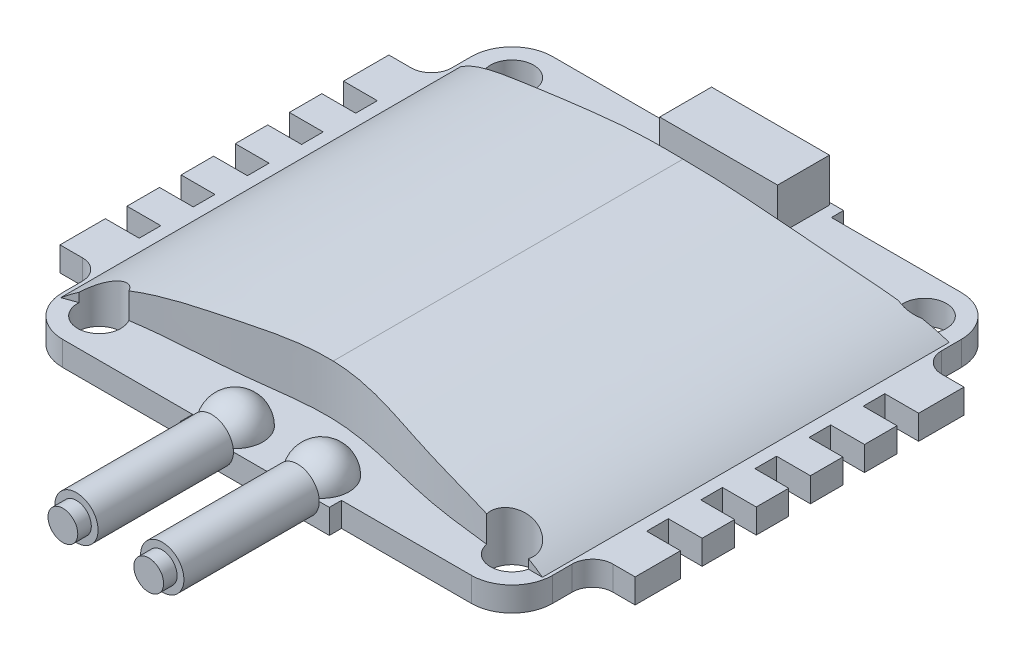
from build123d import *

# Parameters (mm, degrees)
ESQUISSE1_R             = 1.6
BOSS_EXTRU_1_DEPTH      = 1.8
ESQUISSE2_W             = 2.5
ESQUISSE2_H             = 1.6
ENL_V_MAT_EXTRU_1_DEPTH = 2
ESQUISSE4_R             = 1.6
BOSS_EXTRU_2_DEPTH      = 10
ESQUISSE5_R             = 1.1
BOSS_EXTRU_3_DEPTH      = 1
ESQUISSE6_W             = 8.712464533
ESQUISSE6_H             = 3.834081139
BOSS_EXTRU_4_DEPTH      = 3.2
ENL_V_MAT_EXTRU_2_DEPTH = 3.2
BOSS_EXTRU_5_DEPTH      = 15.6
ENL_V_MAT_EXTRU_3_DEPTH = 31.2
ESQUISSE11_R            = 1.6
ENL_V_MAT_EXTRU_4_DEPTH = 31.2
ESQUISSE12_W            = 3.067769554
ESQUISSE12_H            = 3.219264347
ESQUISSE12_W_2          = 3.863117217
ESQUISSE12_H_2          = 3.598001329
ESQUISSE12_W_3          = 4.203980501
ESQUISSE12_H_3          = 3.78736982
ESQUISSE12_H_4          = 3.522253933
ESQUISSE12_W_4          = 2.992022158
ESQUISSE12_H_5          = 2.878401063
BOSS_EXTRU_6_DEPTH      = 1
ESQUISSE13_W            = 1.249832041
ESQUISSE13_H            = 2.234548194
ESQUISSE13_W_2          = 1.287705739
ESQUISSE13_H_2          = 1.931558609
ESQUISSE13_W_3          = 1.325579437
ESQUISSE13_H_3          = 1.893684911
BOSS_EXTRU_7_DEPTH      = 1.4


with BuildPart() as part:
    # Esquisse1 → Boss.-Extru.1 (new body)
    with BuildSketch(Plane(origin=(0, 0, 0), x_dir=(1, 0, 0), z_dir=(0, 1, 0))):
        with BuildLine():
            Line((-5.5, 18.1), (-5.5, 19))
            Line((-5.5, 19), (5.5, 19))
            Line((5.5, 19), (5.5, 18.1))
            Line((5.5, 18.1), (15.1, 18.1))
            ThreePointArc((15.1, 18.1), (17.221320344, 17.221320344), (18.1, 15.1))
            Line((18.1, 15.1), (18.1, 13.65))
            ThreePointArc((18.1, 13.65), (18.539339828, 12.589339828), (19.6, 12.15))
            Line((19.6, 12.15), (21.25, 12.15))
            Line((21.25, 12.15), (21.25, -12.15))
            Line((21.25, -12.15), (19.6, -12.15))
            ThreePointArc((19.6, -12.15), (18.539339828, -12.589339828), (18.1, -13.65))
            Line((18.1, -13.65), (18.1, -15.1))
            ThreePointArc((18.1, -15.1), (17.221320344, -17.221320344), (15.1, -18.1))
            Line((15.1, -18.1), (5.5, -18.1))
            Line((5.5, -18.1), (5.5, -19))
            Line((5.5, -19), (-5.5, -19))
            Line((-5.5, -19), (-5.5, -18.1))
            Line((-5.5, -18.1), (-15.1, -18.1))
            ThreePointArc((-15.1, -18.1), (-17.221320344, -17.221320344), (-18.1, -15.1))
            Line((-18.1, -15.1), (-18.1, -13.65))
            ThreePointArc((-18.1, -13.65), (-18.539339828, -12.589339828), (-19.6, -12.15))
            Line((-19.6, -12.15), (-21.25, -12.15))
            Line((-21.25, -12.15), (-21.25, 12.15))
            Line((-21.25, 12.15), (-19.6, 12.15))
            ThreePointArc((-19.6, 12.15), (-18.539339828, 12.589339828), (-18.1, 13.65))
            Line((-18.1, 13.65), (-18.1, 15.1))
            ThreePointArc((-18.1, 15.1), (-17.221320344, 17.221320344), (-15.1, 18.1))
            Line((-15.1, 18.1), (-5.5, 18.1))
        make_face()
        with Locations(Location((-15.25, 15.25, 0), (0, 0, 270))):
            Circle(ESQUISSE1_R, mode=Mode.SUBTRACT)
        with Locations(Location((15.25, 15.25, 0), (0, 0, 270))):
            Circle(ESQUISSE1_R, mode=Mode.SUBTRACT)
        with Locations(Location((15.25, -15.25, 0), (0, 0, 270))):
            Circle(ESQUISSE1_R, mode=Mode.SUBTRACT)
        with Locations(Location((-15.25, -15.25, 0), (0, 0, 270))):
            Circle(ESQUISSE1_R, mode=Mode.SUBTRACT)
    extrude(amount=BOSS_EXTRU_1_DEPTH)

    # Esquisse2 → Enlèv. mat.-Extru.1 (cut)
    with BuildSketch(Plane(origin=(0, 1.8, 0), x_dir=(1, 0, 0), z_dir=(0, 1, 0))):
        with Locations((-20, 0)):
            Rectangle(ESQUISSE2_W, ESQUISSE2_H)
        with Locations((-20, 4)):
            Rectangle(ESQUISSE2_W, ESQUISSE2_H)
        with Locations((-20, 8)):
            Rectangle(ESQUISSE2_W, ESQUISSE2_H)
        with Locations((-20, -4)):
            Rectangle(ESQUISSE2_W, ESQUISSE2_H)
        with Locations((-20, -8)):
            Rectangle(ESQUISSE2_W, ESQUISSE2_H)
        with Locations((20, -8)):
            Rectangle(ESQUISSE2_W, ESQUISSE2_H)
        with Locations((20, -4)):
            Rectangle(ESQUISSE2_W, ESQUISSE2_H)
        with Locations((20, 8)):
            Rectangle(ESQUISSE2_W, ESQUISSE2_H)
        with Locations((20, 4)):
            Rectangle(ESQUISSE2_W, ESQUISSE2_H)
        with Locations((20, 0)):
            Rectangle(ESQUISSE2_W, ESQUISSE2_H)
    extrude(amount=-ENL_V_MAT_EXTRU_1_DEPTH, mode=Mode.SUBTRACT)

    # Esquisse3 → Révolution1 (revolve)
    with BuildSketch(Plane(origin=(0, 1.8, 0), x_dir=(1, 0, 0), z_dir=(0, 1, 0))):
        with BuildLine():
            Line((-3.186801177, -15.220697473), (-3.186801177, -19.320115289))
            ThreePointArc((-3.186801177, -19.320115289), (-5.236510085, -17.270406381), (-3.186801177, -15.220697473))
        make_face()
    r_volution1 = revolve(axis=Axis((-3.186801177, 1.8, 15.220697473), (0, 0, 1)))

    # Symétrie1: Révolution1 across plane
    add(r_volution1.mirror(Plane(origin=(0, 0, 0), x_dir=(0, 0, 1), z_dir=(1, 0, 0))))

    # Esquisse4 → Boss.-Extru.2 (add)
    with BuildSketch(Plane.XY.offset(19)):
        with Locations((-3.186801177, 1.8)):
            Circle(ESQUISSE4_R)
        with Locations((3.155066641, 1.8)):
            Circle(ESQUISSE4_R)
    extrude(amount=BOSS_EXTRU_2_DEPTH)

    # Esquisse5 → Boss.-Extru.3 (add)
    with BuildSketch(Plane.XY.offset(29)):
        with Locations((-3.186801177, 1.8)):
            Circle(ESQUISSE5_R)
        with Locations((3.155066641, 1.8)):
            Circle(ESQUISSE5_R)
    extrude(amount=BOSS_EXTRU_3_DEPTH)

    # Esquisse6 → Boss.-Extru.4 (add)
    with BuildSketch(Plane(origin=(0, 1.8, 0), x_dir=(1, 0, 0), z_dir=(0, 1, 0))):
        with Locations((0.280971792, 16.903315945)):
            Rectangle(ESQUISSE6_W, ESQUISSE6_H)
    extrude(amount=BOSS_EXTRU_4_DEPTH)

    # Esquisse7 → Enlèv. mat.-Extru.2 (cut)
    with BuildSketch(Plane(origin=(0, 0, -18.820356514), x_dir=(-1, 0, 0), z_dir=(0, 0, -1))):
        Polygon((3.465666112, 4.708829175), (-4.027609697, 4.708829175), (-4.027609697, 4.28888017), (-4.27257995, 4.28888017), (-4.27257995, 3.833935414), (-4.027609697, 3.833935414), (-4.027609697, 2.142474142), (3.465666112, 2.142474142), (3.465666112, 3.833935414), (3.710636365, 3.833935414), (3.710636365, 4.28888017), (3.465666112, 4.28888017), align=None)
    extrude(amount=-ENL_V_MAT_EXTRU_2_DEPTH, mode=Mode.SUBTRACT)


with BuildPart() as body_2:
    # Esquisse9 → Boss.-Extru.5 (new, symmetric)
    with BuildSketch(Plane.XY):
        with BuildLine():
            Line((-17.847532768, 1.8), (17.847532768, 1.8))
            add(Edge.make_bspline(
                [(0, 5.518589903), (2.161733922, 5.518589903), (5.029769177, 5.403714898), (12.242026384, 4.339293522), (16.298826396, 2.963074297), (17.847532768, 1.8)],
                knots=[0, 0, 0, 0, 0.308769941, 0.708153595, 1, 1, 1, 1], degree=3))
            add(Edge.make_bspline(
                [(0, 5.518589903), (-2.161733922, 5.518589903), (-5.029769177, 5.403714898), (-12.242026384, 4.339293522), (-16.298826396, 2.963074297), (-17.847532768, 1.8)],
                knots=[0, 0, 0, 0, 0.308769941, 0.708153595, 1, 1, 1, 1], degree=3))
        make_face()
    extrude(amount=BOSS_EXTRU_5_DEPTH, both=True)

    # Esquisse10 → Enlèv. mat.-Extru.3 (cut)
    with BuildSketch(Plane(origin=(0, 1.8, 0), x_dir=(1, 0, 0), z_dir=(0, 1, 0))):
        with BuildLine():
            Line((19.80794416, 15.118911588), (19.80794416, 29.571030039))
            Line((19.80794416, 29.571030039), (-30.157401828, 26.429634015))
            Line((-30.157401828, 26.429634015), (-20.679039219, 15.118911588))
            add(Edge.make_bspline(
                [(-20.679039219, 15.118911588), (-15.331920911, 12.7470164), (-1.647863492, 12.82009705), (12.057948403, 12.231953741), (19.80794416, 15.118911588)],
                knots=[0, 0, 0, 0, 0.412002892, 1, 1, 1, 1], degree=3))
        make_face()
        with BuildLine():
            Line((-19.883691557, -16.505626412), (-33.612937455, -29.801354811))
            Line((-33.612937455, -29.801354811), (42.17324162, -39.147007981))
            Line((42.17324162, -39.147007981), (21.51226058, -16.922237092))
            add(Edge.make_bspline(
                [(-19.883691557, -16.505626412), (-15.597575438, -13.949476292), (-8.791721797, -14.369633321), (0.885215924, -12.61660088), (9.97905151, -15.714344907), (17.309674428, -15.632963874), (21.51226058, -16.922237092)],
                knots=[0, 0, 0, 0, 0.334206692, 0.481344855, 0.690017727, 1, 1, 1, 1], degree=3))
        make_face()
    extrude(amount=ENL_V_MAT_EXTRU_3_DEPTH, mode=Mode.SUBTRACT)

    # Combiner1: union part
    add(part.part)

    # Esquisse11 → Enlèv. mat.-Extru.4 (cut)
    with BuildSketch(Plane.XZ):
        with Locations(Location((15.25, -15.25, 0), (0, 0, 50.294055852))):
            Circle(ESQUISSE11_R)
        with Locations(Location((-15.25, -15.25, 0), (0, 0, 90))):
            Circle(ESQUISSE11_R)
        with Locations(Location((-15.25, 15.25, 0), (0, 0, 330.069666932))):
            Circle(ESQUISSE11_R)
        with Locations(Location((15.25, 15.25, 0), (0, 0, 169.194294943))):
            Circle(ESQUISSE11_R)
    extrude(amount=-ENL_V_MAT_EXTRU_4_DEPTH, mode=Mode.SUBTRACT)

    # Esquisse12 → Boss.-Extru.6 (add)
    with BuildSketch(Plane.XZ):
        with Locations((-5.169759805, 11.71460359)):
            Rectangle(ESQUISSE12_W, ESQUISSE12_H)
        with Locations((-6.021918015, 5.995675161)):
            Rectangle(ESQUISSE12_W_2, ESQUISSE12_H_2)
        with Locations((5.851486373, 5.995675161)):
            Rectangle(ESQUISSE12_W_3, ESQUISSE12_H_2)
        with Locations((6.911949922, 11.71460359)):
            Rectangle(ESQUISSE12_W, ESQUISSE12_H)
        with Locations((5.851486373, -7.468424551)):
            Rectangle(ESQUISSE12_W_3, ESQUISSE12_H_3)
        with Locations((-6.021918015, -7.600982495)):
            Rectangle(ESQUISSE12_W_2, ESQUISSE12_H_4)
        with Locations((-7.101318413, -12.997984489)):
            Rectangle(ESQUISSE12_W_4, ESQUISSE12_H_5)
        with Locations((4.791022823, -12.997984489)):
            Rectangle(ESQUISSE12_W, ESQUISSE12_H_5)
    extrude(amount=BOSS_EXTRU_6_DEPTH)

    # Esquisse13 → Boss.-Extru.7 (add)
    with BuildSketch(Plane.XZ):
        with Locations((-9.335866608, 8.11660226)):
            Rectangle(ESQUISSE13_W, ESQUISSE13_H)
        with Locations((1.950495458, 8.11660226)):
            Rectangle(ESQUISSE13_W, ESQUISSE13_H)
        with Locations((-2.764779969, -9.987025482)):
            Rectangle(ESQUISSE13_W_2, ESQUISSE13_H_2)
        with Locations((9.146498117, -10.384699313)):
            Rectangle(ESQUISSE13_W_3, ESQUISSE13_H_3)
    extrude(amount=BOSS_EXTRU_7_DEPTH)


solid = body_2.part
